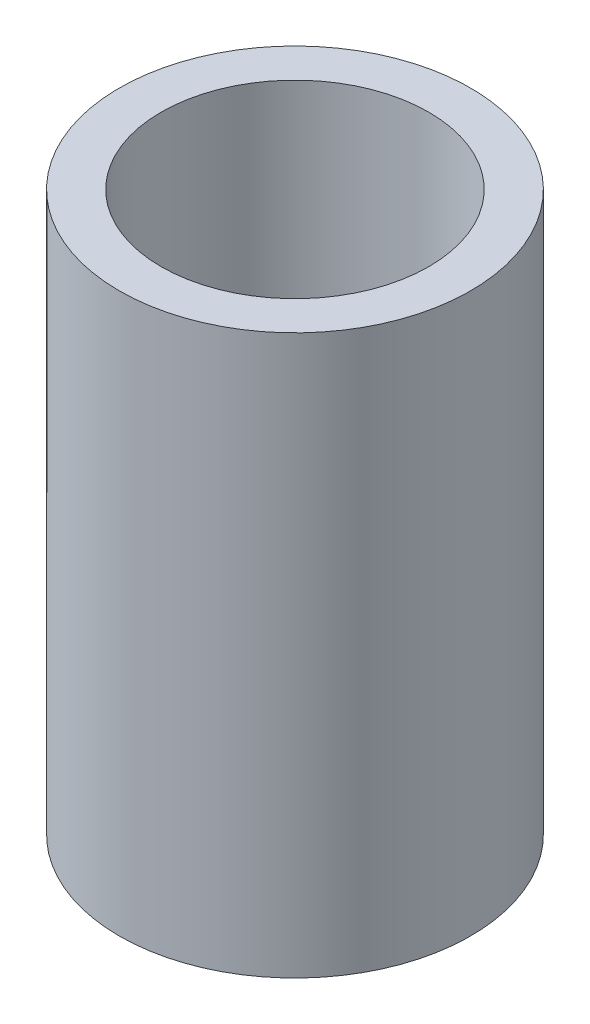
from build123d import *

# Parameters (mm, degrees)
SKETCH1_R           = 52.5
SKETCH1_R_2         = 40
BOSS_EXTRUDE1_DEPTH = 167
SKETCH2_R           = 52.5
BOSS_EXTRUDE2_DEPTH = 5


with BuildPart() as part:
    # Sketch1 → Boss-Extrude1 (new body)
    with BuildSketch(Plane(origin=(0, 0, 0), x_dir=(1, 0, 0), z_dir=(0, 1, 0))):
        with Locations(Location((0, 0, 0), (0, 0, 270))):
            Circle(SKETCH1_R)
        with Locations(Location((0, 0, 0), (0, 0, 270))):
            Circle(SKETCH1_R_2, mode=Mode.SUBTRACT)
    extrude(amount=BOSS_EXTRUDE1_DEPTH)

    # Sketch2 → Boss-Extrude2 (add)
    with BuildSketch(Plane.XZ):
        with Locations(Location((0, 0, 0), (0, 0, 90))):
            Circle(SKETCH2_R)
    extrude(amount=-BOSS_EXTRUDE2_DEPTH)


solid = part.part
